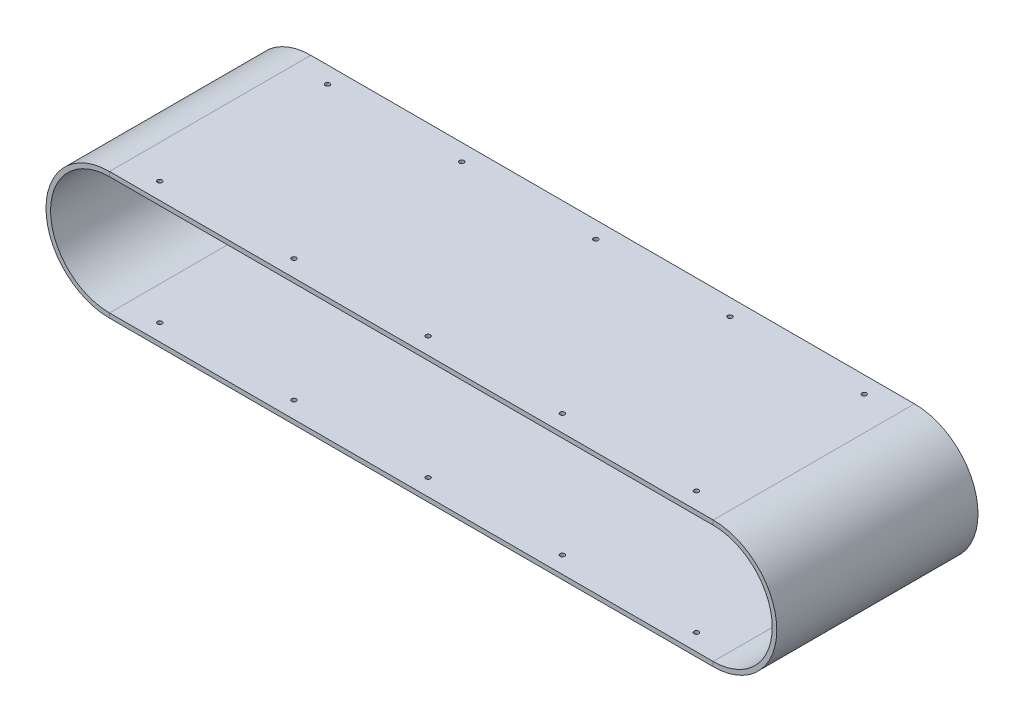
from build123d import *

# Parameters (mm, degrees)
SKETCH2_W          = 152.4
SKETCH2_H          = 3.429
SKETCH3_R          = 1.75
CUT_EXTRUDE1_DEPTH = 521.008112247


with BuildPart() as part:
    # Sweep1: sweep along a path in Sketch1
    with BuildLine(Plane.XY) as sweep1_path:
        Line((0, 46.39945), (457.2, 46.39945))
        ThreePointArc((457.2, 46.39945), (503.59945, 0), (457.2, -46.39945))
        Line((457.2, -46.39945), (0, -46.39945))
        ThreePointArc((0, -46.39945), (-46.39945, 0), (0, 46.39945))
    # Sketch2 → Sweep1 (sweep)
    with BuildSketch(Plane(origin=(0, 0, 0), x_dir=(0, 0, -1), z_dir=(1, 0, 0))):
        with Locations((0, 46.39945)):
            Rectangle(SKETCH2_W, SKETCH2_H)
    sweep(path=sweep1_path.line)

    # Sketch3 → Cut-Extrude1 (cut, through all)
    with BuildSketch(Plane(origin=(0, 48.11395, 0), x_dir=(1, 0, 0), z_dir=(0, 1, 0))):
        with Locations(Location((25.4, -63.5, 0), (0, 0, 180))):
            Circle(SKETCH3_R)
        with Locations((25.4, 63.5)):
            Circle(SKETCH3_R)
        with Locations(Location((127, -63.5, 0), (0, 0, 180))):
            Circle(SKETCH3_R)
        with Locations((127, 63.5)):
            Circle(SKETCH3_R)
        with Locations(Location((228.6, -63.5, 0), (0, 0, 180))):
            Circle(SKETCH3_R)
        with Locations((228.6, 63.5)):
            Circle(SKETCH3_R)
        with Locations(Location((330.2, -63.5, 0), (0, 0, 180))):
            Circle(SKETCH3_R)
        with Locations((330.2, 63.5)):
            Circle(SKETCH3_R)
        with Locations(Location((431.8, -63.5, 0), (0, 0, 180))):
            Circle(SKETCH3_R)
        with Locations((431.8, 63.5)):
            Circle(SKETCH3_R)
        with Locations((533.4, -63.5)):
            Circle(SKETCH3_R)
        with Locations((533.4, 63.5)):
            Circle(SKETCH3_R)
    extrude(amount=-CUT_EXTRUDE1_DEPTH, mode=Mode.SUBTRACT)


solid = part.part
